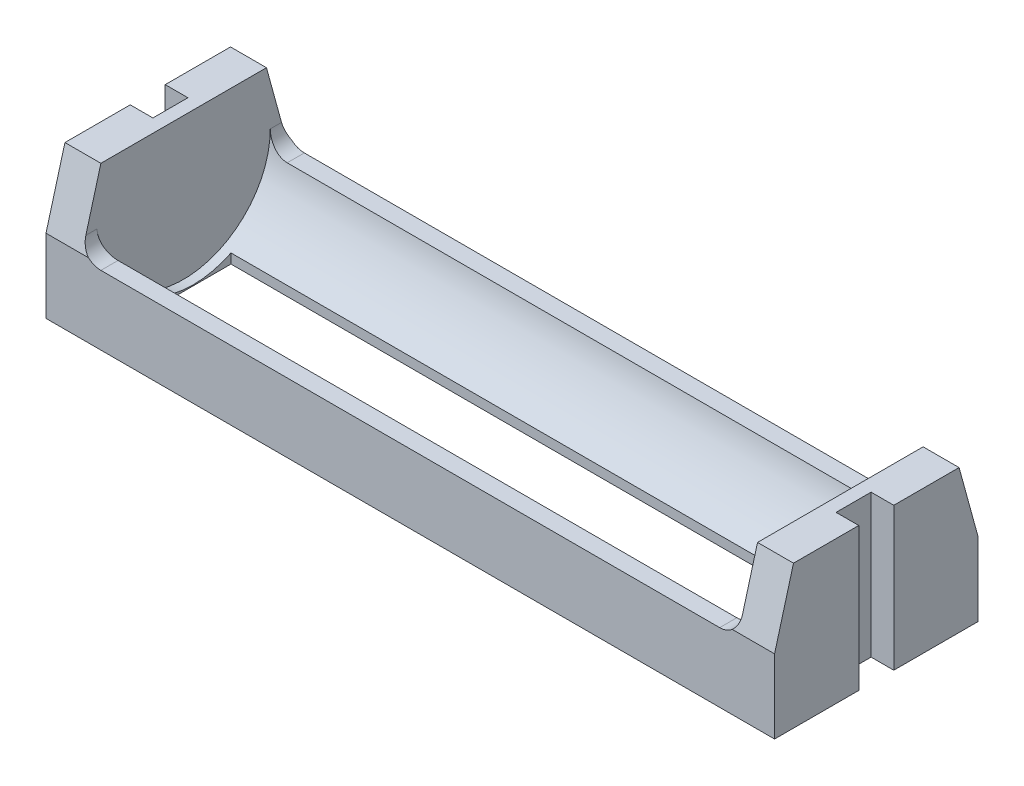
from build123d import *
from OCP.BRepFilletAPI import BRepFilletAPI_MakeChamfer

# Parameters (mm, degrees)
SKETCH_1_W          = 77
SKETCH_1_H          = 21.5
EXTRUDE_1_DEPTH     = 15.1
CHAMFER_1_SIZE      = 7.3
CHAMFER_1_SIZE2     = 2
CUT_EXTRUDE_1_DEPTH = 47.610192018
CUT_EXTRUDE_START   = -3.8
SKETCH_3_R          = 9.15
CUT_EXTRUDE_2_DEPTH = 69.4
SKETCH_4_W          = 67.4
SKETCH_4_H          = 8
SKETCH_4_W_2        = 2.4
SKETCH_4_H_2        = 3.7
CUT_EXTRUDE_3_DEPTH = 43.729644302


with BuildPart() as part:
    # Эскиз1 → Бобышка-Вытянуть1 (new body)
    with BuildSketch(Plane(origin=(0, 0, 0), x_dir=(1, 0, 0), z_dir=(0, 1, 0))):
        Rectangle(SKETCH_1_W, SKETCH_1_H)
    extrude(amount=EXTRUDE_1_DEPTH)

    # Фаска1: one chamfer whose edges measure the first distance from different faces: ONE call of the kernel's chamfer builder (chamfer() names one face for all edges)
    chamfer_1_edges_1 = [part.edges().sort_by_distance(p)[0] for p in [
        (0, 15.1, 10.75),
    ]]
    chamfer_1_side_1 = [part.faces().sort_by_distance(p)[0] for p in [
        (0, 7.55, 10.75),
    ]]
    chamfer_1_edges_2 = [part.edges().sort_by_distance(p)[0] for p in [
        (0, 15.1, -10.75),
    ]]
    chamfer_1_side_2 = [part.faces().sort_by_distance(p)[0] for p in [
        (0, 7.55, -10.75),
    ]]
    chamfer_1 = BRepFilletAPI_MakeChamfer(part.part.solid().wrapped)
    for e in chamfer_1_edges_1:
        chamfer_1.Add(CHAMFER_1_SIZE, CHAMFER_1_SIZE2, e.wrapped, chamfer_1_side_1[0].wrapped)  # the first distance lies on this face
    for e in chamfer_1_edges_2:
        chamfer_1.Add(CHAMFER_1_SIZE, CHAMFER_1_SIZE2, e.wrapped, chamfer_1_side_2[0].wrapped)  # the first distance lies on this face
    add(Compound.cast(chamfer_1.Shape()), mode=Mode.REPLACE)

    # Эскиз2 → Вырез-Вытянуть1 (cut, through all)
    with BuildSketch(Plane.XY.offset(10.75)):
        with BuildLine():
            Line((-34.7, 15.1), (34.7, 15.1))
            Line((34.7, 15.1), (34.7, 9.3))
            ThreePointArc((34.7, 9.3), (34.114213562, 7.885786438), (32.7, 7.3))
            Line((32.7, 7.3), (-32.7, 7.3))
            ThreePointArc((-32.7, 7.3), (-34.114213562, 7.885786438), (-34.7, 9.3))
            Line((-34.7, 9.3), (-34.7, 15.1))
        make_face()
    extrude(amount=-CUT_EXTRUDE_1_DEPTH, mode=Mode.SUBTRACT)

    # Эскиз3 → Вырез-Вытянуть2 (cut)
    with BuildSketch(Plane(origin=(38.5, 0, 0), x_dir=(0, 0, -1), z_dir=(1, 0, 0)).offset(CUT_EXTRUDE_START)):
        with Locations((0, 9.25)):
            Circle(SKETCH_3_R)
    extrude(amount=-CUT_EXTRUDE_2_DEPTH, mode=Mode.SUBTRACT)

    # Эскиз4 → Вырез-Вытянуть3 (cut, through all)
    with BuildSketch(Plane.XZ):
        Rectangle(SKETCH_4_W, SKETCH_4_H)
        with Locations((-37.3, 0)):
            Rectangle(SKETCH_4_W_2, SKETCH_4_H_2)
        with Locations((37.3, 0)):
            Rectangle(SKETCH_4_W_2, SKETCH_4_H_2)
    extrude(amount=-CUT_EXTRUDE_3_DEPTH, mode=Mode.SUBTRACT)


solid = part.part
